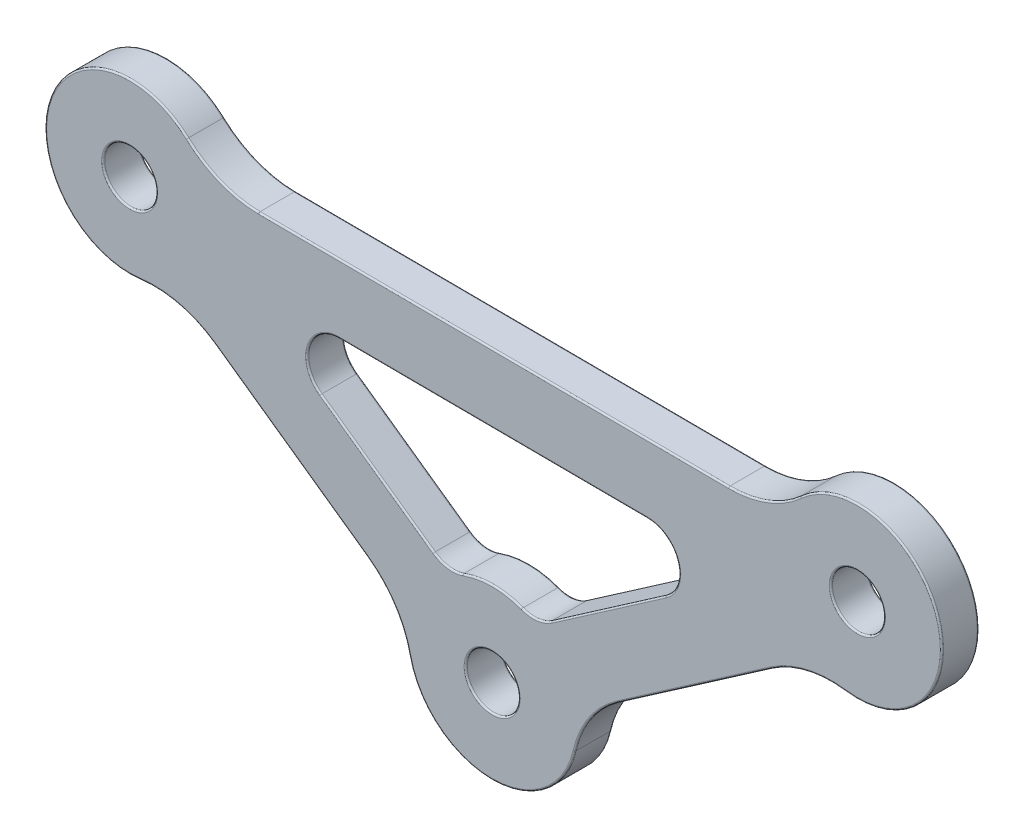
from build123d import *

# Parameters (mm, degrees)
SKETCH1_R             = 8
SKETCH1_R_2           = 2.5
BOSS_EXTRUDE2_DEPTH   = 3.5
BOSS_EXTRUDE2_2_DEPTH = 3.5
BOSS_EXTRUDE2_3_DEPTH = 3.5
EXTRUDE_THIN1_DEPTH   = 3.5
FILLET1_R             = 3
FILLET2_R             = 10
FILLET3_R             = 0.15


with BuildPart() as part:
    # Sketch1 → Boss-Extrude2 (new body)
    with BuildSketch(Plane.XY):
        with Locations((-68.342723434, 229.207729162)):
            Circle(SKETCH1_R)
        with Locations((-68.342723434, 229.207729162)):
            Circle(SKETCH1_R_2, mode=Mode.SUBTRACT)
    extrude(amount=-BOSS_EXTRUDE2_DEPTH)



with BuildPart() as body_2:
    # Sketch1 → Boss-Extrude2 2 (new body)
    with BuildSketch(Plane.XY):
        with Locations((0.465028024, 228.833022645)):
            Circle(SKETCH1_R)
        with Locations((0.465028024, 228.833022645)):
            Circle(SKETCH1_R_2, mode=Mode.SUBTRACT)
    extrude(amount=-BOSS_EXTRUDE2_2_DEPTH)


with BuildPart() as body_3:
    # Sketch1 → Boss-Extrude2 3 (new body)
    with BuildSketch(Plane.XY):
        with Locations((-34.070033869, 204.930522774)):
            Circle(SKETCH1_R)
        with Locations((-34.070033869, 204.930522774)):
            Circle(SKETCH1_R_2, mode=Mode.SUBTRACT)
    extrude(amount=-BOSS_EXTRUDE2_3_DEPTH)


with BuildPart() as part_1:
    add(part.part)

    add(body_2.part)  # Extrude-Thin1 merges body 2

    add(body_3.part)  # Extrude-Thin1 merges body 3
    # Sketch2 → Extrude-Thin1 (add)
    with BuildSketch(Plane.XY):
        Polygon((-6.318150451, 228.090735786), (-30.986051803, 211.017521593), (-27.286855394, 205.672809633), (-2.618954042, 222.746023826), align=None)
        Polygon((-37.087539027, 211.050748474), (-61.568031573, 228.39161018), (-65.325218276, 223.087503461), (-40.84472573, 205.746641756), align=None)
        Polygon((-61.456545975, 225.9201809), (-6.456545975, 225.620667285), (-6.421149436, 232.120570906), (-61.421149436, 232.420084522), align=None)
    extrude(amount=-EXTRUDE_THIN1_DEPTH)

    # Fillet1
    fillet1_edges = [part_1.edges().sort_by_distance(p)[0] for p in [
        (-38.156598675, 211.808021453, -1.75),
        (-29.908808038, 211.763106443, -1.75),
        (-9.860200516, 225.639202573, -1.75),
        (-58.052891433, 225.901645612, -1.75),
    ]]
    fillet(fillet1_edges, radius=FILLET1_R)

    # Fillet2
    fillet2_edges = [part_1.edges().sort_by_distance(p)[0] for p in [
        (-64.256158628, 222.330230482, -1.75),
        (-41.913785378, 206.503914735, -1.75),
        (-26.20961163, 206.418394483, -1.75),
        (-3.696197807, 222.000438976, -1.75),
        (-6.827261075, 232.122782469, -1.75),
        (-61.015037797, 232.417872959, -1.75),
    ]]
    fillet(fillet2_edges, radius=FILLET2_R)

    # Fillet3
    fillet3_edges = [part_1.edges().sort_by_distance(p)[0] for p in [
        (-23.080208972, 216.489334784, -3.5),
        (-23.080208972, 216.489334784, 0),
        (-34.026468898, 212.930404154, -3.5),
        (-34.026468898, 212.930404154, 0),
        (-44.933319004, 216.608340312, 0),
        (-44.933319004, 216.608340312, -3.5),
        (-33.956545975, 225.770424093, 0),
        (-33.956545975, 225.770424093, -3.5),
        (-29.818284774, 212.243548852, 0),
        (-29.818284774, 212.243548852, -3.5),
        (-38.241884033, 212.289421264, 0),
        (-38.241884033, 212.289421264, -3.5),
        (-51.410780809, 223.767560948, -3.5),
        (-51.410780809, 223.767560948, 0),
        (-16.525159689, 223.577584247, 0),
        (-16.525159689, 223.577584247, -3.5),
        (-75.959245671, 231.654888539, 0),
        (-75.959245671, 231.654888539, -3.5),
        (-53.084972003, 214.417072609, -3.5),
        (-53.084972003, 214.417072609, 0),
        (-34.11359884, 196.930641394, -3.5),
        (-34.11359884, 196.930641394, 0),
        (-14.952904718, 214.20941673, -3.5),
        (-14.952904718, 214.20941673, 0),
        (8.107750739, 231.19708472, -3.5),
        (8.107750739, 231.19708472, 0),
        (-33.921149436, 232.270327714, 0),
        (-33.921149436, 232.270327714, -3.5),
        (-63.638320016, 221.055527505, 0),
        (-63.638320016, 221.055527505, -3.5),
        (-43.321269138, 206.663857531, 0),
        (-43.321269138, 206.663857531, -3.5),
        (-4.327882669, 220.732540531, 0),
        (-4.327882669, 220.732540531, -3.5),
        (-24.800469398, 206.562998773, 0),
        (-24.800469398, 206.562998773, -3.5),
        (-8.064504428, 232.812580349, 0),
        (-8.064504428, 232.812580349, -3.5),
        (-59.770355179, 233.09415501, -3.5),
        (-59.770355179, 233.09415501, 0),
        (-36.570033869, 204.930522774, -3.5),
        (-36.570033869, 204.930522774, 0),
        (-70.842723434, 229.207729162, -3.5),
        (-70.842723434, 229.207729162, 0),
        (-2.034971976, 228.833022645, -3.5),
        (-2.034971976, 228.833022645, 0),
    ]]
    fillet(fillet3_edges, radius=FILLET3_R)


solid = part_1.part
